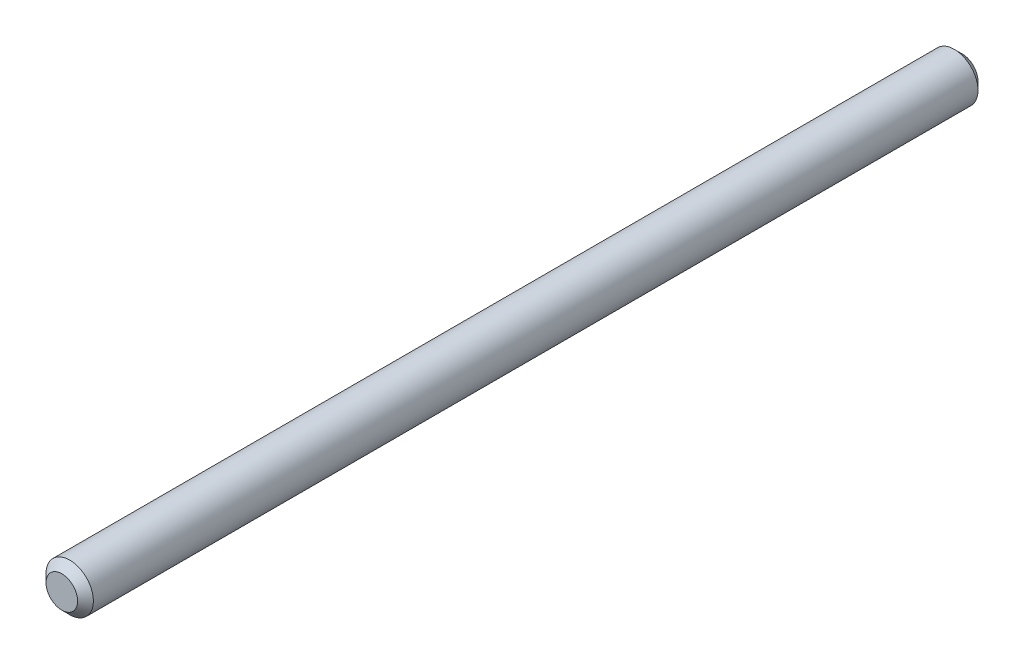
from build123d import *

# Parameters (mm, degrees)
SKETCH1_R           = 3
BOSS_EXTRUDE1_DEPTH = 114
CHAMFER1_SIZE       = 1


with BuildPart() as part:
    # Sketch1 → Boss-Extrude1 (new body)
    with BuildSketch(Plane.XY):
        with Locations(Location((0, 0, 0), (0, 0, 180))):
            Circle(SKETCH1_R)
    extrude(amount=BOSS_EXTRUDE1_DEPTH)

    # Chamfer1
    chamfer1_edges = [part.edges().sort_by_distance(p)[0] for p in [
        (3, 0, 0),
        (3, 0, 114),
    ]]
    chamfer(chamfer1_edges, length=CHAMFER1_SIZE)


solid = part.part
